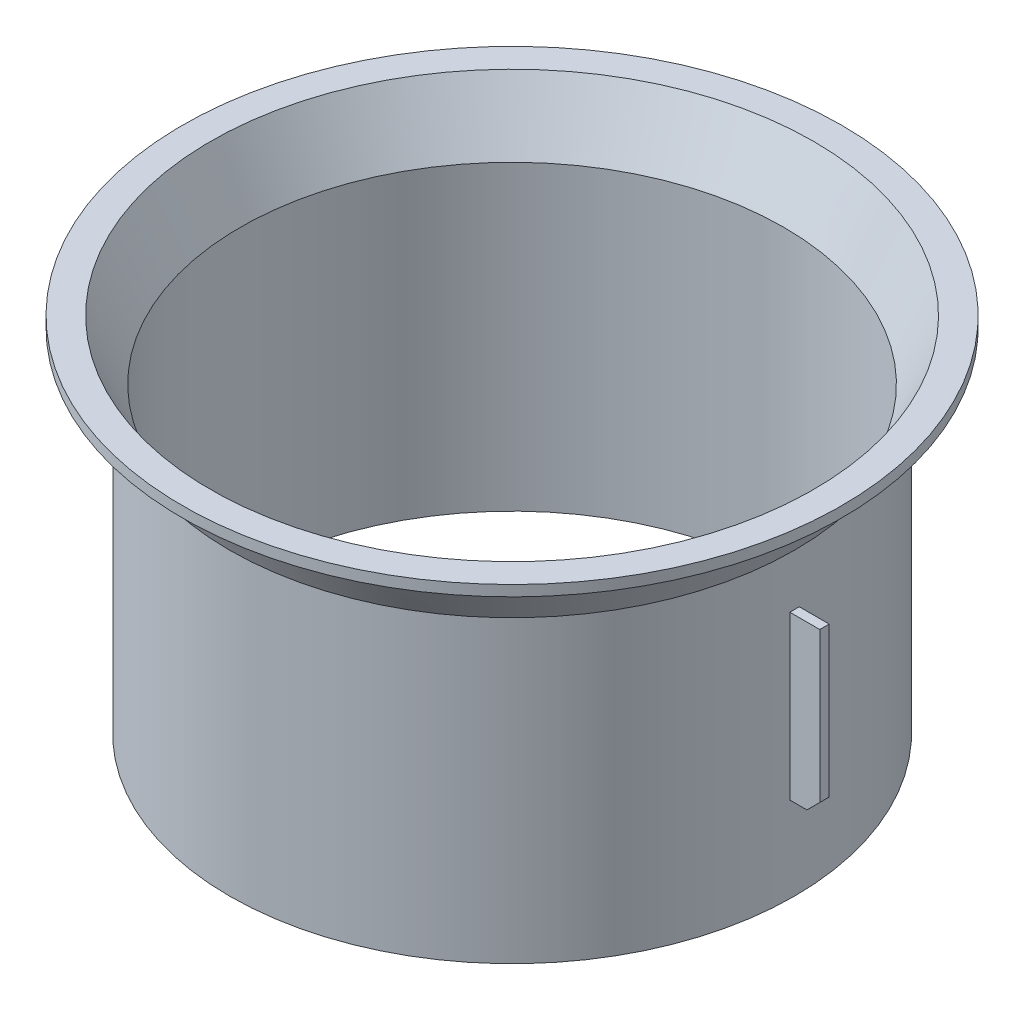
from build123d import *

# Parameters (mm, degrees)
BOSS_EXTRU_1_START = -10
BOSS_EXTRU_1_DEPTH = 19
CHANFREIN1_SIZE    = 1.5


with BuildPart() as part:
    # Esquisse1 → Révolution1 (revolve)
    with BuildSketch(Plane.XY, mode=Mode.PRIVATE) as r_volution1_sk:
        Polygon((33, 0), (33, 35), (36, 41), (38.5, 41), (38.5, 42.25), (35.227457514, 42.25), (31.75, 35.295084972), (31.75, 0), align=None)
    revolve(r_volution1_sk.sketch.rotate(Axis((0, 0, 0), (0, 1, 0)), 90), axis=Axis((0, 0, 0), (0, 1, 0)))

    # Esquisse2 → Boss.-Extru.1 (add)
    with BuildSketch(Plane.XZ.offset(BOSS_EXTRU_1_START)):
        Polygon((-32.995416348, 0.55), (-36.495416348, 0.55), (-36.495416348, -0.55), (-32.995416348, -0.55), (-32.495416348, 0), align=None)
        Polygon((32.995416348, -0.55), (36.495416348, -0.55), (36.495416348, 0.55), (32.995416348, 0.55), (32.495416348, 0), align=None)
    extrude(amount=-BOSS_EXTRU_1_DEPTH)

    # Chanfrein1
    chanfrein1_edges = [part.edges().sort_by_distance(p)[0] for p in [
        (-36.495416348, 10, 0),
        (36.495416348, 10, 0),
    ]]
    chamfer(chanfrein1_edges, length=CHANFREIN1_SIZE)


solid = part.part
